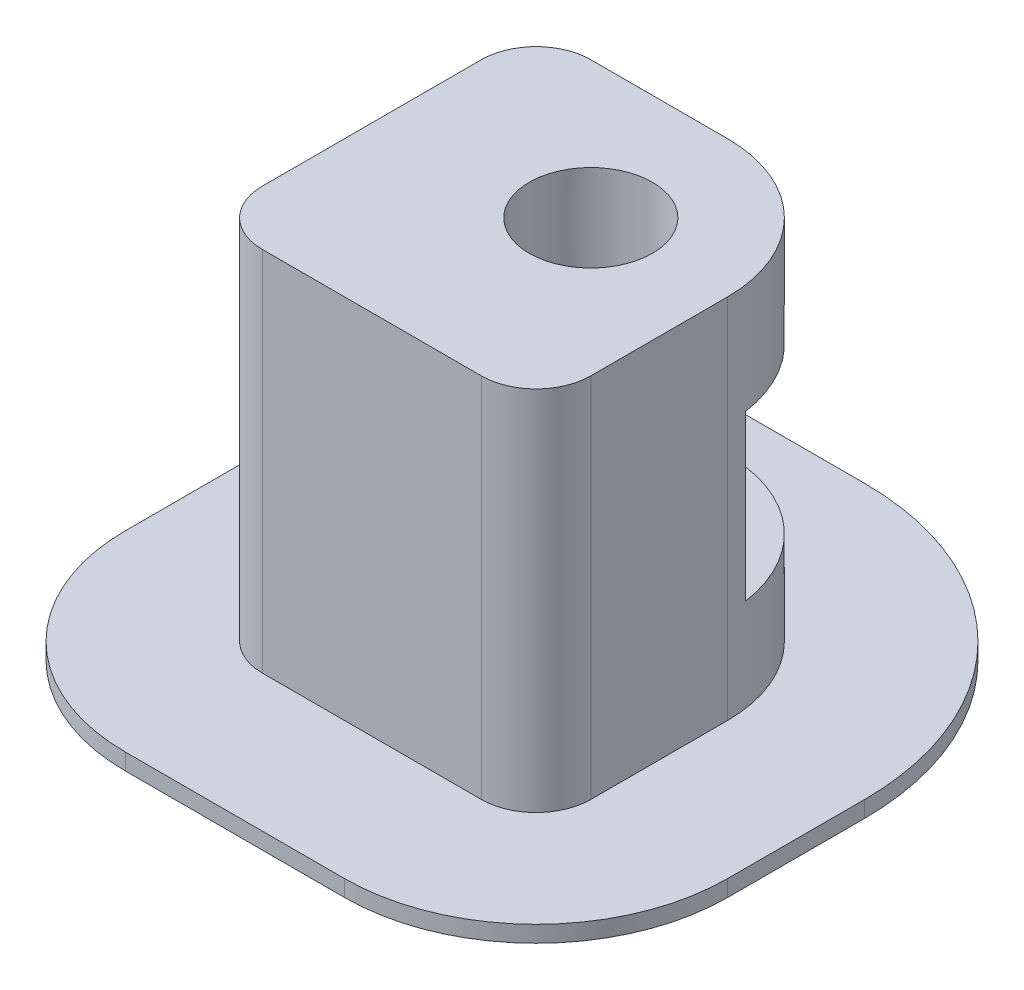
from build123d import *

# Parameters (mm, degrees)
SKETCH1_R           = 1.6
BOSS_EXTRUDE1_DEPTH = 7
FILLET1_R           = 2
CUT_EXTRUDE1_START  = 3
CUT_EXTRUDE1_DEPTH  = 3
CUT_EXTRUDE2_START  = -3
CUT_EXTRUDE2_DEPTH  = 3
SKETCH3_R           = 2.25
CUT_EXTRUDE3_DEPTH  = 7
SKETCH4_R           = 1.6
BOSS_EXTRUDE3_DEPTH = 0.6


with BuildPart() as part:
    # Sketch1 → Boss-Extrude1 (new, symmetric)
    with BuildSketch(Plane(origin=(0, 0, 0), x_dir=(1, 0, 0), z_dir=(0, 1, 0))):
        with BuildLine():
            Line((0, 5), (-7, 5))
            Line((-7, 5), (-7, -7))
            Line((-7, -7), (5, -7))
            Line((5, -7), (5, 0))
            ThreePointArc((5, 0), (3.535533906, 3.535533906), (0, 5))
        make_face()
        with Locations(Location((0, 0, 0), (0, 0, 270))):
            Circle(SKETCH1_R, mode=Mode.SUBTRACT)
    extrude(amount=BOSS_EXTRUDE1_DEPTH, both=True)

    # Fillet1
    fillet1_edges = [part.edges().sort_by_distance(p)[0] for p in [
        (5, 0, 7),
        (-7, 0, 7),
        (-7, 0, -5),
    ]]
    fillet(fillet1_edges, radius=FILLET1_R)

    # Sketch2 → Cut-Extrude1 (cut)
    with BuildSketch(Plane(origin=(0, 0, 0), x_dir=(1, 0, 0), z_dir=(0, 1, 0)).offset(CUT_EXTRUDE1_START)):
        Polygon((-0.896575472, 3.346065215), (0.757359313, 5), (5, 5), (5, 0.757359313), (3.346065215, -0.896575472), (0.896575472, -3.346065215), (-2.449489743, -2.449489743), (-3.346065215, 0.896575472), align=None)
    extrude(amount=-CUT_EXTRUDE1_DEPTH, mode=Mode.SUBTRACT)

    # Sketch2<2> → Cut-Extrude2 (cut)
    with BuildSketch(Plane(origin=(0, 0, 0), x_dir=(1, 0, 0), z_dir=(0, 1, 0)).offset(CUT_EXTRUDE2_START)):
        Polygon((-0.896575472, 3.346065215), (0.757359313, 5), (5, 5), (5, 0.757359313), (3.346065215, -0.896575472), (0.896575472, -3.346065215), (-2.449489743, -2.449489743), (-3.346065215, 0.896575472), align=None)
    extrude(amount=CUT_EXTRUDE2_DEPTH, mode=Mode.SUBTRACT)

    # Sketch3 → Cut-Extrude3 (cut)
    with BuildSketch(Plane(origin=(0, 7, 0), x_dir=(1, 0, 0), z_dir=(0, 1, 0))):
        with Locations(Location((0, 0, 0), (0, 0, 270))):
            Circle(SKETCH3_R)
    extrude(amount=-CUT_EXTRUDE3_DEPTH, mode=Mode.SUBTRACT)

    # Sketch4 → Boss-Extrude3 (add)
    with BuildSketch(Plane.XZ.offset(7)):
        with BuildLine():
            Line((10, 0), (10, 5))
            ThreePointArc((10, 5), (7.949747468, 9.949747468), (3, 12))
            Line((3, 12), (-5, 12))
            ThreePointArc((-5, 12), (-9.949747468, 9.949747468), (-12, 5))
            Line((-12, 5), (-12, -3))
            ThreePointArc((-12, -3), (-9.949747468, -7.949747468), (-5, -10))
            Line((-5, -10), (0, -10))
            ThreePointArc((0, -10), (7.071067812, -7.071067812), (10, 0))
        make_face()
        with Locations(Location((0, 0, 0), (0, 0, 270))):
            Circle(SKETCH4_R, mode=Mode.SUBTRACT)
    extrude(amount=-BOSS_EXTRUDE3_DEPTH)


solid = part.part
